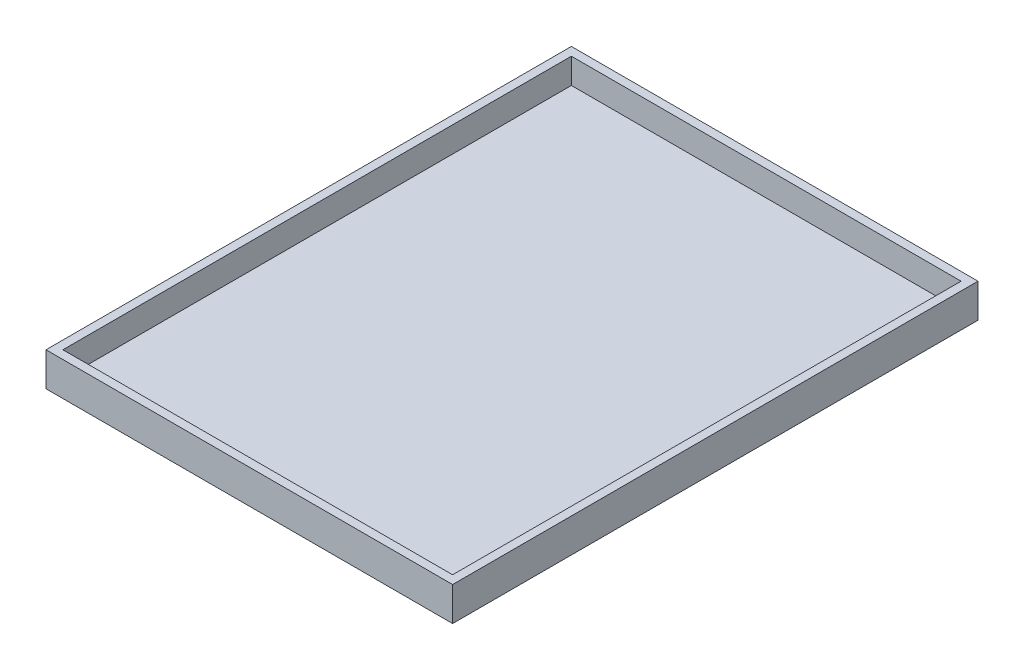
from build123d import *

# Parameters (mm, degrees)
SKETCH1_W           = 384.8
SKETCH1_H           = 497.2
BOSS_EXTRUDE1_DEPTH = 4
SKETCH2_W           = 384.8
SKETCH2_H           = 497.2
SKETCH2_W_2         = 368.8
SKETCH2_H_2         = 481.2
BOSS_EXTRUDE2_DEPTH = 24


with BuildPart() as part:
    # Sketch1 → Boss-Extrude1 (new, symmetric)
    with BuildSketch(Plane(origin=(0, 0, 0), x_dir=(1, 0, 0), z_dir=(0, 1, 0))):
        Rectangle(SKETCH1_W, SKETCH1_H)
    extrude(amount=BOSS_EXTRUDE1_DEPTH, both=True)

    # Sketch2 → Boss-Extrude2 (add)
    with BuildSketch(Plane(origin=(0, 4, 0), x_dir=(1, 0, 0), z_dir=(0, 1, 0))):
        Rectangle(SKETCH2_W, SKETCH2_H)
        Rectangle(SKETCH2_W_2, SKETCH2_H_2, mode=Mode.SUBTRACT)
    extrude(amount=BOSS_EXTRUDE2_DEPTH)


solid = part.part
